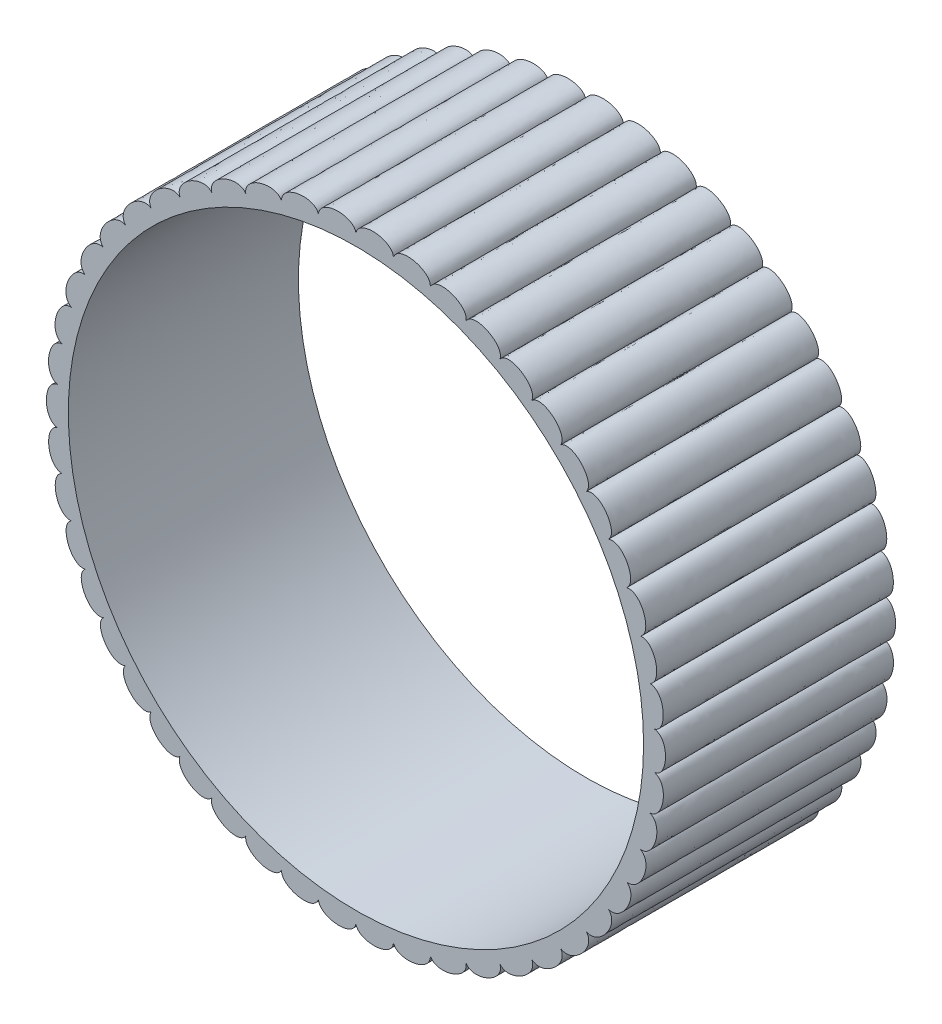
from build123d import *

# Parameters (mm, degrees)
SKETCH1_R           = 25
BOSS_EXTRUDE1_DEPTH = 20


with BuildPart() as part:
    # Sketch1 → Boss-Extrude1 (new body)
    with BuildSketch(Plane.XY):
        with BuildLine():
            add(Edge.make_bspline(
                [(0, 26), (0.123917372, 26.620226891), (0.985031752, 26.915195692), (2.439657303, 26.794530121), (3.211249747, 26.380336489), (3.258664073, 25.794982234)],
                knots=[0, 0, 0, 0, 0.438491403, 0.538491403, 1, 1, 1, 1], degree=3))
            add(Edge.make_bspline(
                [(3.258664073, 25.794982234), (3.459339361, 26.394787486), (4.35063299, 26.57950412), (5.778664979, 26.27747711), (6.492260959, 25.769843341), (6.465937066, 25.183162189)],
                knots=[0, 0, 0, 0, 0.438491403, 0.538491403, 1, 1, 1, 1], degree=3))
            add(Edge.make_bspline(
                [(6.465937066, 25.183162189), (6.740205501, 25.753086515), (7.647622148, 25.824637891), (9.026539656, 25.346012586), (9.670885336, 24.752944371), (9.57123837, 24.174188633)],
                knots=[0, 0, 0, 0, 0.438491403, 0.538491403, 1, 1, 1, 1], degree=3))
            add(Edge.make_bspline(
                [(9.57123837, 24.174188633), (9.914774575, 24.705243985), (10.824003735, 24.662501695), (12.13206041, 24.014826304), (12.696994075, 23.34567668), (12.525595527, 22.783973681)],
                knots=[0, 0, 0, 0, 0.438491403, 0.538491403, 1, 1, 1, 1], degree=3))
            add(Edge.make_bspline(
                [(12.525595527, 22.783973681), (12.932981731, 23.267785), (13.829684318, 23.111423114), (15.046251324, 22.304911865), (15.522863632, 21.570233723), (15.28241656, 21.034441854)],
                knots=[0, 0, 0, 0, 0.438491403, 0.538491403, 1, 1, 1, 1], degree=3))
            add(Edge.make_bspline(
                [(15.28241656, 21.034441854), (15.747228039, 21.463379145), (16.617262518, 21.195863585), (17.723153866, 20.243235641), (18.103928357, 19.454615294), (17.798224754, 18.953184313)],
                knots=[0, 0, 0, 0, 0.438491403, 0.538491403, 1, 1, 1, 1], degree=3))
            add(Edge.make_bspline(
                [(17.798224754, 18.953184313), (18.313131154, 19.32048298), (19.142776561, 18.946032626), (20.120551685, 17.862311498), (20.399483317, 17.03218596), (20.033344312, 16.573023733)],
                knots=[0, 0, 0, 0, 0.438491403, 0.538491403, 1, 1, 1, 1], degree=3))
            add(Edge.make_bspline(
                [(20.033344312, 16.573023733), (20.590225251, 16.872891257), (21.366397582, 16.397411414), (22.200636384, 15.199688033), (22.373326239, 14.341148879), (21.952526063, 13.931496669)],
                knots=[0, 0, 0, 0, 0.438491403, 0.538491403, 1, 1, 1, 1], degree=3))
            add(Edge.make_bspline(
                [(21.952526063, 13.931496669), (22.542599195, 14.159203959), (23.25305775, 13.590193228), (23.930603786, 12.297356408), (23.994328442, 11.423943314), (23.525503364, 11.070261581)],
                knots=[0, 0, 0, 0, 0.438491403, 0.538491403, 1, 1, 1, 1], degree=3))
            add(Edge.make_bspline(
                [(23.525503364, 11.070261581), (24.139462885, 11.222217557), (24.773003306, 10.568649578), (25.28317127, 9.201088126), (25.236925751, 8.326575338), (24.727469424, 8.034441854)],
                knots=[0, 0, 0, 0, 0.438491403, 0.538491403, 1, 1, 1, 1], degree=3))
            add(Edge.make_bspline(
                [(24.727469424, 8.034441854), (25.355632824, 8.10825008), (25.902263802, 7.380432009), (26.23700804, 5.959713188), (26.081521665, 5.097892295), (25.539468519, 4.871914179)],
                knots=[0, 0, 0, 0, 0.438491403, 0.538491403, 1, 1, 1, 1], degree=3))
            add(Edge.make_bspline(
                [(25.539468519, 4.871914179), (26.171929287, 4.866410655), (26.623030124, 4.07582062), (26.77707152, 2.624350013), (26.514796402, 1.788812445), (25.948694939, 1.632553508)],
                knots=[0, 0, 0, 0, 0.438491403, 0.538491403, 1, 1, 1, 1], degree=3))
            add(Edge.make_bspline(
                [(25.948694939, 1.632553508), (26.57547879, 1.547825027), (26.923935357, 0.706931104), (26.894844586, -0.75240073), (26.529916961, -1.548478046), (25.948694939, -1.632553508)],
                knots=[0, 0, 0, 0, 0.438491403, 0.538491403, 1, 1, 1, 1], degree=3))
            add(Edge.make_bspline(
                [(25.948694939, -1.632553508), (26.559917118, -1.795170726), (26.800234046, -2.673107138), (26.588469887, -4.117285664), (26.126644881, -4.861348113), (25.539468519, -4.871914179)],
                knots=[0, 0, 0, 0, 0.438491403, 0.538491403, 1, 1, 1, 1], degree=3))
            add(Edge.make_bspline(
                [(25.539468519, -4.871914179), (26.125489687, -5.109855564), (26.253877035, -6.010988883), (25.862779135, -7.417238543), (25.311340004, -8.097551816), (24.727469424, -8.034441854)],
                knots=[0, 0, 0, 0, 0.438491403, 0.538491403, 1, 1, 1, 1], degree=3))
            add(Edge.make_bspline(
                [(24.727469424, -8.034441854), (25.279047676, -8.343954927), (25.293480699, -9.254073742), (24.729216906, -10.60021714), (24.096860175, -11.20605229), (23.525503364, -11.070261581)],
                knots=[0, 0, 0, 0, 0.438491403, 0.538491403, 1, 1, 1, 1], degree=3))
            add(Edge.make_bspline(
                [(23.525503364, -11.070261581), (24.033939983, -11.446465137), (23.934191063, -12.351216331), (23.205660154, -13.61602398), (22.502358466, -14.137826625), (21.952526063, -13.931496669)],
                knots=[0, 0, 0, 0, 0.438491403, 0.538491403, 1, 1, 1, 1], degree=3))
            add(Edge.make_bspline(
                [(21.952526063, -13.931496669), (22.409802699, -14.368457754), (22.197444937, -15.25357286), (21.316136278, -16.417097988), (20.552981122, -16.846638989), (20.033344312, -16.573023733)],
                knots=[0, 0, 0, 0, 0.438491403, 0.538491403, 1, 1, 1, 1], degree=3))
            add(Edge.make_bspline(
                [(20.033344312, -16.573023733), (20.43224944, -17.063851209), (20.110631843, -17.915371432), (19.090444201, -18.959264554), (18.279470987, -19.289769792), (17.798224754, -18.953184313)],
                knots=[0, 0, 0, 0, 0.438491403, 0.538491403, 1, 1, 1, 1], degree=3))
            add(Edge.make_bspline(
                [(17.798224754, -18.953184313), (18.132467401, -19.490137537), (17.706662072, -20.294633896), (16.563684413, -21.202432191), (15.717682676, -21.428689402), (15.28241656, -21.034441854)],
                knots=[0, 0, 0, 0, 0.438491403, 0.538491403, 1, 1, 1, 1], degree=3))
            add(Edge.make_bspline(
                [(15.28241656, -21.034441854), (15.54672552, -21.609052753), (15.023447663, -22.353837859), (13.775705429, -23.111224808), (12.90801712, -23.22966578), (12.525595527, -22.783973681)],
                knots=[0, 0, 0, 0, 0.438491403, 0.538491403, 1, 1, 1, 1], degree=3))
            add(Edge.make_bspline(
                [(12.525595527, -22.783973681), (12.71580249, -23.387180298), (12.10330451, -24.060508445), (10.77047534, -24.655539603), (9.894784423, -24.664296451), (9.57123837, -24.174188633)],
                knots=[0, 0, 0, 0, 0.438491403, 0.538491403, 1, 1, 1, 1], degree=3))
            add(Edge.make_bspline(
                [(9.57123837, -24.174188633), (9.684343658, -24.796478039), (8.992285014, -25.387730441), (7.595388421, -25.811021811), (6.725505064, -25.709956434), (6.465937066, -25.183162189)],
                knots=[0, 0, 0, 0, 0.438491403, 0.538491403, 1, 1, 1, 1], degree=3))
            add(Edge.make_bspline(
                [(6.465937066, -25.183162189), (6.500156942, -25.814720509), (5.739451812, -26.314572761), (4.30051769, -26.559448785), (3.450160473, -26.350155045), (3.258664073, -25.794982234)],
                knots=[0, 0, 0, 0, 0.438491403, 0.538491403, 1, 1, 1, 1], degree=3))
            add(Edge.make_bspline(
                [(3.258664073, -25.794982234), (3.213458868, -26.425849416), (2.396104026, -26.82641855), (0.937825225, -26.889017387), (0.120404791, -26.574795971), (0, -26)],
                knots=[0, 0, 0, 0, 0.438491403, 0.538491403, 1, 1, 1, 1], degree=3))
            add(Edge.make_bspline(
                [(0, -26), (-0.123917372, -26.620226891), (-0.985031752, -26.915195692), (-2.439657303, -26.794530121), (-3.211249747, -26.380336489), (-3.258664073, -25.794982234)],
                knots=[0, 0, 0, 0, 0.438491403, 0.538491403, 1, 1, 1, 1], degree=3))
            add(Edge.make_bspline(
                [(-3.258664073, -25.794982234), (-3.459339361, -26.394787486), (-4.35063299, -26.57950412), (-5.778664979, -26.27747711), (-6.492260959, -25.769843341), (-6.465937066, -25.183162189)],
                knots=[0, 0, 0, 0, 0.438491403, 0.538491403, 1, 1, 1, 1], degree=3))
            add(Edge.make_bspline(
                [(-6.465937066, -25.183162189), (-6.740205501, -25.753086515), (-7.647622148, -25.824637891), (-9.026539656, -25.346012586), (-9.670885336, -24.752944371), (-9.57123837, -24.174188633)],
                knots=[0, 0, 0, 0, 0.438491403, 0.538491403, 1, 1, 1, 1], degree=3))
            add(Edge.make_bspline(
                [(-9.57123837, -24.174188633), (-9.914774575, -24.705243985), (-10.824003735, -24.662501695), (-12.13206041, -24.014826304), (-12.696994075, -23.34567668), (-12.525595527, -22.783973681)],
                knots=[0, 0, 0, 0, 0.438491403, 0.538491403, 1, 1, 1, 1], degree=3))
            add(Edge.make_bspline(
                [(-12.525595527, -22.783973681), (-12.932981731, -23.267785), (-13.829684318, -23.111423114), (-15.046251324, -22.304911865), (-15.522863632, -21.570233723), (-15.28241656, -21.034441854)],
                knots=[0, 0, 0, 0, 0.438491403, 0.538491403, 1, 1, 1, 1], degree=3))
            add(Edge.make_bspline(
                [(-15.28241656, -21.034441854), (-15.747228039, -21.463379145), (-16.617262518, -21.195863585), (-17.723153866, -20.243235641), (-18.103928357, -19.454615294), (-17.798224754, -18.953184313)],
                knots=[0, 0, 0, 0, 0.438491403, 0.538491403, 1, 1, 1, 1], degree=3))
            add(Edge.make_bspline(
                [(-17.798224754, -18.953184313), (-18.313131154, -19.32048298), (-19.142776561, -18.946032626), (-20.120551685, -17.862311498), (-20.399483317, -17.03218596), (-20.033344312, -16.573023733)],
                knots=[0, 0, 0, 0, 0.438491403, 0.538491403, 1, 1, 1, 1], degree=3))
            add(Edge.make_bspline(
                [(-20.033344312, -16.573023733), (-20.590225251, -16.872891257), (-21.366397582, -16.397411414), (-22.200636384, -15.199688033), (-22.373326239, -14.341148879), (-21.952526063, -13.931496669)],
                knots=[0, 0, 0, 0, 0.438491403, 0.538491403, 1, 1, 1, 1], degree=3))
            add(Edge.make_bspline(
                [(-21.952526063, -13.931496669), (-22.542599195, -14.159203959), (-23.25305775, -13.590193228), (-23.930603786, -12.297356408), (-23.994328442, -11.423943314), (-23.525503364, -11.070261581)],
                knots=[0, 0, 0, 0, 0.438491403, 0.538491403, 1, 1, 1, 1], degree=3))
            add(Edge.make_bspline(
                [(-23.525503364, -11.070261581), (-24.139462885, -11.222217557), (-24.773003306, -10.568649578), (-25.28317127, -9.201088126), (-25.236925751, -8.326575338), (-24.727469424, -8.034441854)],
                knots=[0, 0, 0, 0, 0.438491403, 0.538491403, 1, 1, 1, 1], degree=3))
            add(Edge.make_bspline(
                [(-24.727469424, -8.034441854), (-25.355632824, -8.10825008), (-25.902263802, -7.380432009), (-26.23700804, -5.959713188), (-26.081521665, -5.097892295), (-25.539468519, -4.871914179)],
                knots=[0, 0, 0, 0, 0.438491403, 0.538491403, 1, 1, 1, 1], degree=3))
            add(Edge.make_bspline(
                [(-25.539468519, -4.871914179), (-26.171929287, -4.866410655), (-26.623030124, -4.07582062), (-26.77707152, -2.624350013), (-26.514796402, -1.788812445), (-25.948694939, -1.632553508)],
                knots=[0, 0, 0, 0, 0.438491403, 0.538491403, 1, 1, 1, 1], degree=3))
            add(Edge.make_bspline(
                [(-25.948694939, -1.632553508), (-26.57547879, -1.547825027), (-26.923935357, -0.706931104), (-26.894844586, 0.75240073), (-26.529916961, 1.548478046), (-25.948694939, 1.632553508)],
                knots=[0, 0, 0, 0, 0.438491403, 0.538491403, 1, 1, 1, 1], degree=3))
            add(Edge.make_bspline(
                [(-25.948694939, 1.632553508), (-26.559917118, 1.795170726), (-26.800234046, 2.673107138), (-26.588469887, 4.117285664), (-26.126644881, 4.861348113), (-25.539468519, 4.871914179)],
                knots=[0, 0, 0, 0, 0.438491403, 0.538491403, 1, 1, 1, 1], degree=3))
            add(Edge.make_bspline(
                [(-25.539468519, 4.871914179), (-26.125489687, 5.109855564), (-26.253877035, 6.010988883), (-25.862779135, 7.417238543), (-25.311340004, 8.097551816), (-24.727469424, 8.034441854)],
                knots=[0, 0, 0, 0, 0.438491403, 0.538491403, 1, 1, 1, 1], degree=3))
            add(Edge.make_bspline(
                [(-24.727469424, 8.034441854), (-25.279047676, 8.343954927), (-25.293480699, 9.254073742), (-24.729216906, 10.60021714), (-24.096860175, 11.20605229), (-23.525503364, 11.070261581)],
                knots=[0, 0, 0, 0, 0.438491403, 0.538491403, 1, 1, 1, 1], degree=3))
            add(Edge.make_bspline(
                [(-23.525503364, 11.070261581), (-24.033939983, 11.446465137), (-23.934191063, 12.351216331), (-23.205660154, 13.61602398), (-22.502358466, 14.137826625), (-21.952526063, 13.931496669)],
                knots=[0, 0, 0, 0, 0.438491403, 0.538491403, 1, 1, 1, 1], degree=3))
            add(Edge.make_bspline(
                [(-21.952526063, 13.931496669), (-22.409802699, 14.368457754), (-22.197444937, 15.25357286), (-21.316136278, 16.417097988), (-20.552981122, 16.846638989), (-20.033344312, 16.573023733)],
                knots=[0, 0, 0, 0, 0.438491403, 0.538491403, 1, 1, 1, 1], degree=3))
            add(Edge.make_bspline(
                [(-20.033344312, 16.573023733), (-20.43224944, 17.063851209), (-20.110631843, 17.915371432), (-19.090444201, 18.959264554), (-18.279470987, 19.289769792), (-17.798224754, 18.953184313)],
                knots=[0, 0, 0, 0, 0.438491403, 0.538491403, 1, 1, 1, 1], degree=3))
            add(Edge.make_bspline(
                [(-17.798224754, 18.953184313), (-18.132467401, 19.490137537), (-17.706662072, 20.294633896), (-16.563684413, 21.202432191), (-15.717682676, 21.428689402), (-15.28241656, 21.034441854)],
                knots=[0, 0, 0, 0, 0.438491403, 0.538491403, 1, 1, 1, 1], degree=3))
            add(Edge.make_bspline(
                [(-15.28241656, 21.034441854), (-15.54672552, 21.609052753), (-15.023447663, 22.353837859), (-13.775705429, 23.111224808), (-12.90801712, 23.22966578), (-12.525595527, 22.783973681)],
                knots=[0, 0, 0, 0, 0.438491403, 0.538491403, 1, 1, 1, 1], degree=3))
            add(Edge.make_bspline(
                [(-12.525595527, 22.783973681), (-12.71580249, 23.387180298), (-12.10330451, 24.060508445), (-10.77047534, 24.655539603), (-9.894784423, 24.664296451), (-9.57123837, 24.174188633)],
                knots=[0, 0, 0, 0, 0.438491403, 0.538491403, 1, 1, 1, 1], degree=3))
            add(Edge.make_bspline(
                [(-9.57123837, 24.174188633), (-9.684343658, 24.796478039), (-8.992285014, 25.387730441), (-7.595388421, 25.811021811), (-6.725505064, 25.709956434), (-6.465937066, 25.183162189)],
                knots=[0, 0, 0, 0, 0.438491403, 0.538491403, 1, 1, 1, 1], degree=3))
            add(Edge.make_bspline(
                [(-6.465937066, 25.183162189), (-6.500156942, 25.814720509), (-5.739451812, 26.314572761), (-4.30051769, 26.559448785), (-3.450160473, 26.350155045), (-3.258664073, 25.794982234)],
                knots=[0, 0, 0, 0, 0.438491403, 0.538491403, 1, 1, 1, 1], degree=3))
            add(Edge.make_bspline(
                [(-3.258664073, 25.794982234), (-3.213458868, 26.425849416), (-2.396104026, 26.82641855), (-0.937825225, 26.889017387), (-0.120404791, 26.574795971), (0, 26)],
                knots=[0, 0, 0, 0, 0.438491403, 0.538491403, 1, 1, 1, 1], degree=3))
        make_face()
        Circle(SKETCH1_R, mode=Mode.SUBTRACT)
    extrude(amount=BOSS_EXTRUDE1_DEPTH)


solid = part.part
